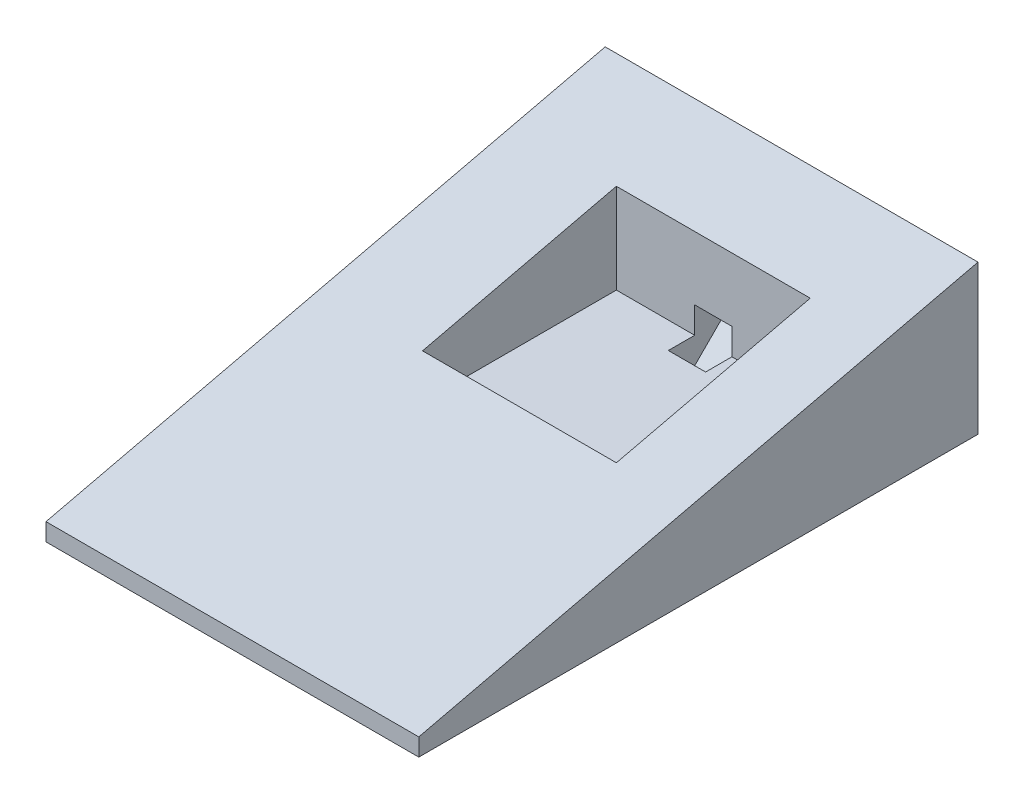
from build123d import *

# Parameters (mm, degrees)
SKETCH1_W               = 100
SKETCH1_H               = 150
BOSS_EXTRUDE1_DEPTH     = 40
SKETCH3_W               = 52
SKETCH3_H               = 52
CUT_EXTRUDE2_DEPTH      = 30
CUT_EXTRUDE1_DEPTH      = 132.244047484
CUT_EXTRUDE5_DEPTH      = 10
CUT_EXTRUDE5_DEPTH_BACK = 5
SKETCH4_W               = 10
SKETCH4_H               = 10


with BuildPart() as part:
    # Sketch1 → Boss-Extrude1 (new body)
    with BuildSketch(Plane(origin=(0, 0, 0), x_dir=(1, 0, 0), z_dir=(0, 1, 0))):
        Rectangle(SKETCH1_W, SKETCH1_H)
    extrude(amount=BOSS_EXTRUDE1_DEPTH)

    # Sketch3 → Cut-Extrude2 (cut)
    with BuildSketch(Plane(origin=(0, 40, 0), x_dir=(1, 0, 0), z_dir=(0, 1, 0))):
        with Locations((4, 24)):
            Rectangle(SKETCH3_W, SKETCH3_H)
    extrude(amount=-CUT_EXTRUDE2_DEPTH, mode=Mode.SUBTRACT)

    # Sketch2 → Cut-Extrude1 (cut, through all)
    with BuildSketch(Plane(origin=(50, 0, 0), x_dir=(0, 0, -1), z_dir=(1, 0, 0))):
        Polygon((75, 40), (-95, 0), (-95, 40), align=None)
    extrude(amount=-CUT_EXTRUDE1_DEPTH, mode=Mode.SUBTRACT)

    # Sketch4 → Cut-Extrude5 (cut, two sides: drawn at the far end of the back side and taken through both)
    with BuildSketch(Plane(origin=(0, -20, -20), x_dir=(-1, 0, 0), z_dir=(0, 0.7071067811865477, 0.7071067811865475)).offset(-CUT_EXTRUDE5_DEPTH_BACK)):
        with Locations((-4, -42.426406871)):
            Rectangle(SKETCH4_W, SKETCH4_H)
    extrude(amount=CUT_EXTRUDE5_DEPTH + CUT_EXTRUDE5_DEPTH_BACK, mode=Mode.SUBTRACT)


solid = part.part
